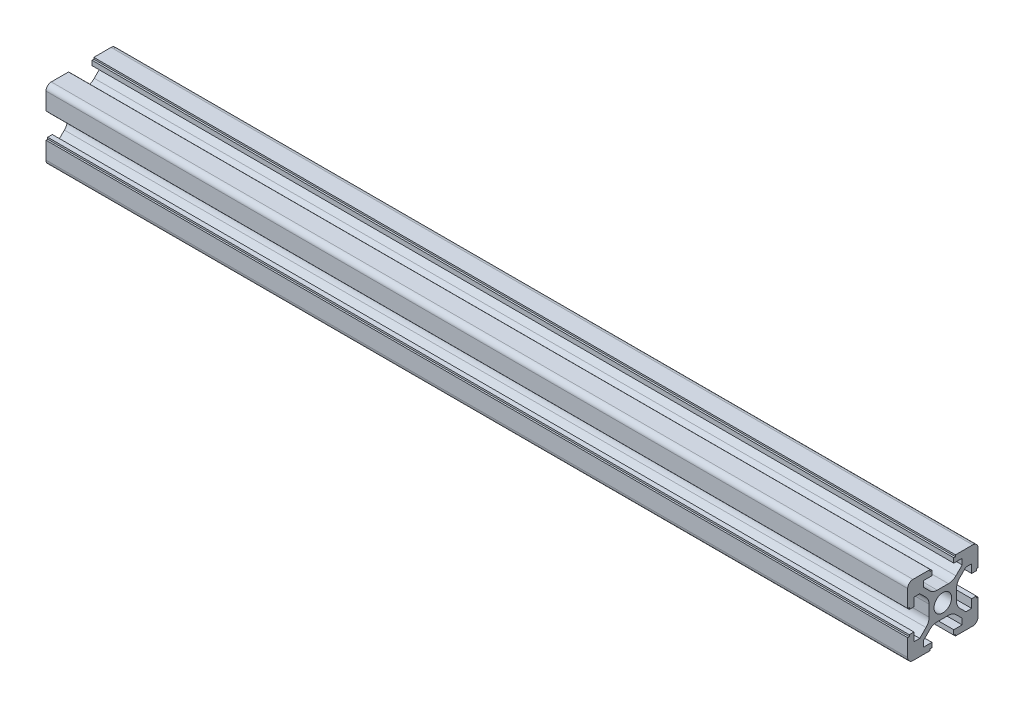
from build123d import *

# Parameters (mm, degrees)
EXTRUDE_1_DEPTH = 245
FILLET_1_R      = 1.5
FILLET_2_R      = 3


with BuildPart() as part:
    # 草图1 → 凸台-拉伸1 (new body)
    with BuildSketch(Plane(origin=(0, 0, 0), x_dir=(0, 0, -1), z_dir=(1, 0, 0))):
        Polygon((-10, 10), (-10, 3.6), (-9.530955747, 3.6), (-9.530955747, 3.1), (-8.2, 3.1), (-8.2, 5.5), (-6.560660172, 5.5), (-3.9, 2.839339828), (-3.9, 0), (-3.9, -2.839339828), (-6.560660172, -5.5), (-8.2, -5.5), (-8.2, -3.1), (-9.530955747, -3.1), (-9.530955747, -3.6), (-10, -3.6), (-10, -10), (-3.6, -10), (-3.6, -9.530955747), (-3.1, -9.530955747), (-3.1, -8.2), (-5.5, -8.2), (-5.5, -6.560660172), (-2.839339828, -3.9), (0, -3.9), (2.839339828, -3.9), (5.5, -6.560660172), (5.5, -8.2), (3.1, -8.2), (3.1, -9.530955747), (3.6, -9.530955747), (3.6, -10), (10, -10), (10, -3.6), (9.530955747, -3.6), (9.530955747, -3.1), (8.2, -3.1), (8.2, -5.5), (6.560660172, -5.5), (3.9, -2.839339828), (3.9, 0), (3.9, 2.839339828), (6.560660172, 5.5), (8.2, 5.5), (8.2, 3.1), (9.530955747, 3.1), (9.530955747, 3.6), (10, 3.6), (10, 10), (3.6, 10), (3.6, 9.530955747), (3.1, 9.530955747), (3.1, 8.2), (5.5, 8.2), (5.5, 6.560660172), (2.839339828, 3.9), (0, 3.9), (-2.839339828, 3.9), (-5.5, 6.560660172), (-5.5, 8.2), (-3.1, 8.2), (-3.1, 9.530955747), (-3.6, 9.530955747), (-3.6, 10), align=None)
        with BuildLine():
            ThreePointArc((0, 2.5), (-1.767766953, 1.767766953), (-2.5, 0))
            ThreePointArc((-2.5, 0), (-1.767766953, -1.767766953), (0, -2.5))
            ThreePointArc((0, -2.5), (1.767766953, -1.767766953), (2.5, 0))
            ThreePointArc((2.5, 0), (1.767766953, 1.767766953), (0, 2.5))
        make_face(mode=Mode.SUBTRACT)
    extrude(amount=EXTRUDE_1_DEPTH)

    # 圆角1
    fillet_1_edges = [part.edges().sort_by_distance(p)[0] for p in [
        (122.5, -10, -10),
        (122.5, -10, 10),
        (122.5, 10, 10),
        (122.5, 10, -10),
    ]]
    fillet(fillet_1_edges, radius=FILLET_1_R)

    # 圆角2
    fillet_2_edges = [part.edges().sort_by_distance(p)[0] for p in [
        (122.5, -3.9, -2.839339828),
        (122.5, -3.9, 2.839339828),
        (122.5, -2.839339828, 3.9),
        (122.5, 2.839339828, 3.9),
        (122.5, 3.9, 2.839339828),
        (122.5, 3.9, -2.839339828),
        (122.5, 2.839339828, -3.9),
        (122.5, -2.839339828, -3.9),
    ]]
    fillet(fillet_2_edges, radius=FILLET_2_R)


solid = part.part
